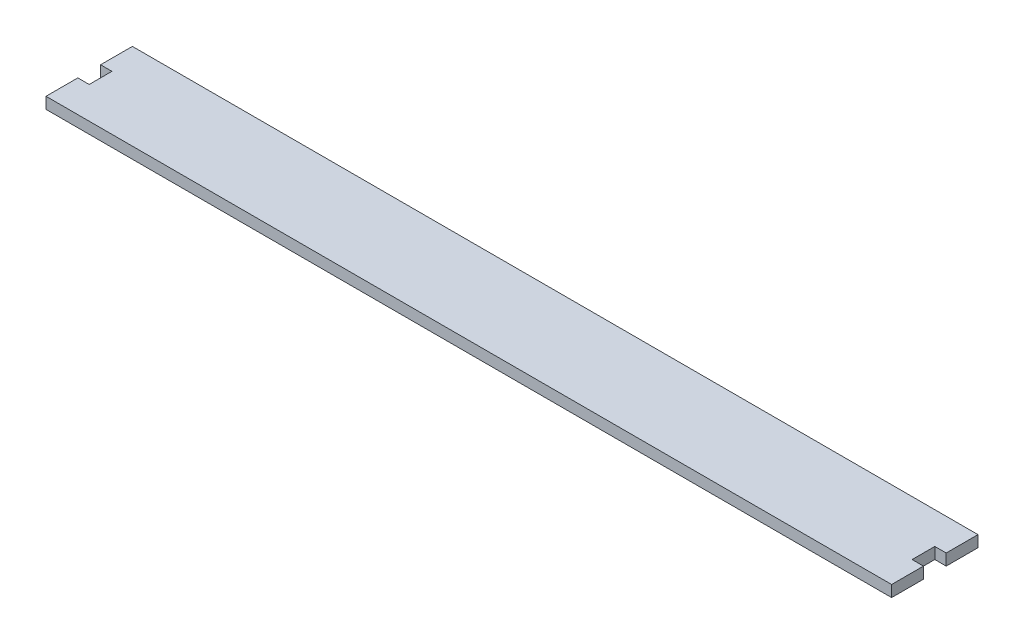
from build123d import *

# Parameters (mm, degrees)
BOSS_EXTRUDE1_DEPTH = 5


with BuildPart() as part:
    # Sketch1 → Boss-Extrude1 (new body)
    with BuildSketch(Plane(origin=(0, 0, 0), x_dir=(1, 0, 0), z_dir=(0, 1, 0))):
        Polygon((186, 19), (-186, 19), (-186, 5), (-181, 5), (-181, -5), (-186, -5), (-186, -19), (186, -19), (186, -5), (181, -5), (181, 5), (186, 5), align=None)
    extrude(amount=BOSS_EXTRUDE1_DEPTH)


solid = part.part
